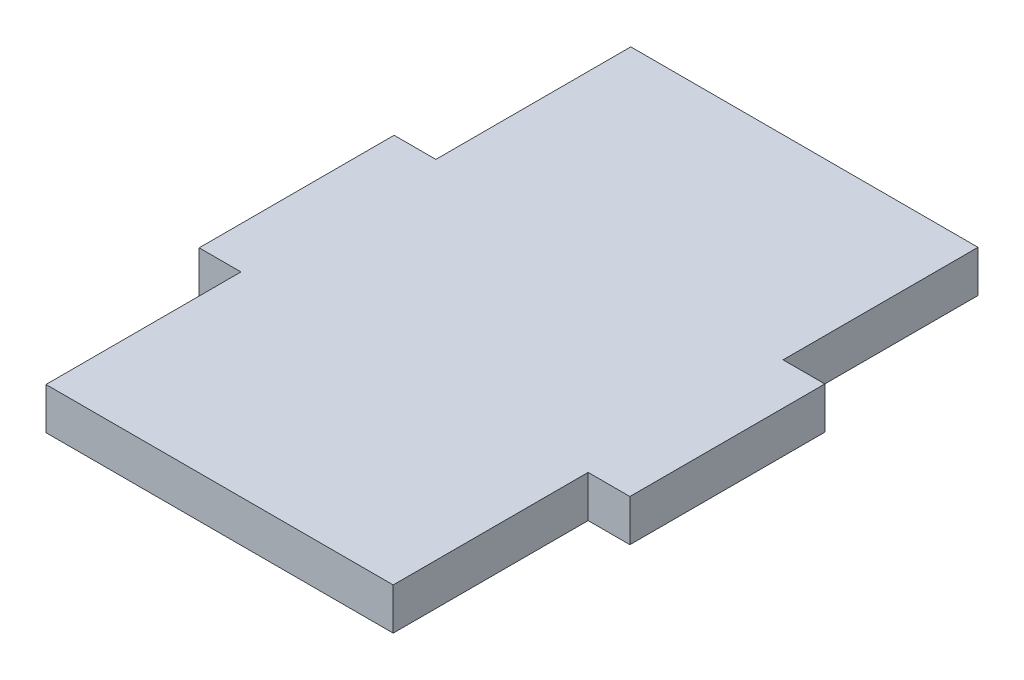
from build123d import *

# Parameters (mm, degrees)
BOSS_EXTRUDE2_DEPTH = 3.175


with BuildPart() as part:
    # Sketch1 → Boss-Extrude2 (new body)
    with BuildSketch(Plane(origin=(0, 0, 0), x_dir=(1, 0, 0), z_dir=(0, 1, 0))):
        Polygon((0, -29.633333333), (3.175, -29.633333333), (3.175, -44.45), (29.5656, -44.45), (29.5656, -29.633333333), (32.7406, -29.633333333), (32.7406, -14.816666667), (29.5656, -14.816666667), (29.5656, 0), (3.175, 0), (3.175, -14.816666667), (0, -14.816666667), align=None)
    extrude(amount=BOSS_EXTRUDE2_DEPTH)


solid = part.part
